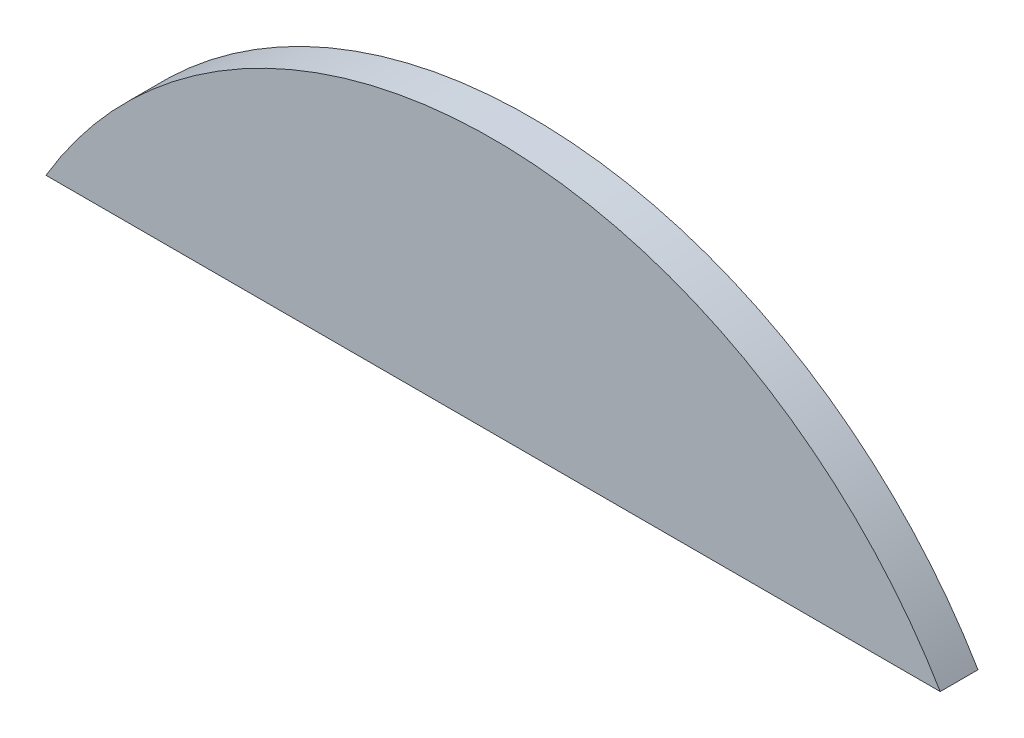
from build123d import *

# Parameters (mm, degrees)
EXTRUDE_1_DEPTH = 2


with BuildPart() as part:
    # 草图1 → 凸台-拉伸1 (new body)
    with BuildSketch(Plane.XY):
        with BuildLine():
            Line((-23.669600757, 14), (23.669600757, 14))
            ThreePointArc((23.669600757, 14), (0, 27.5), (-23.669600757, 14))
        make_face()
    extrude(amount=EXTRUDE_1_DEPTH)


solid = part.part
